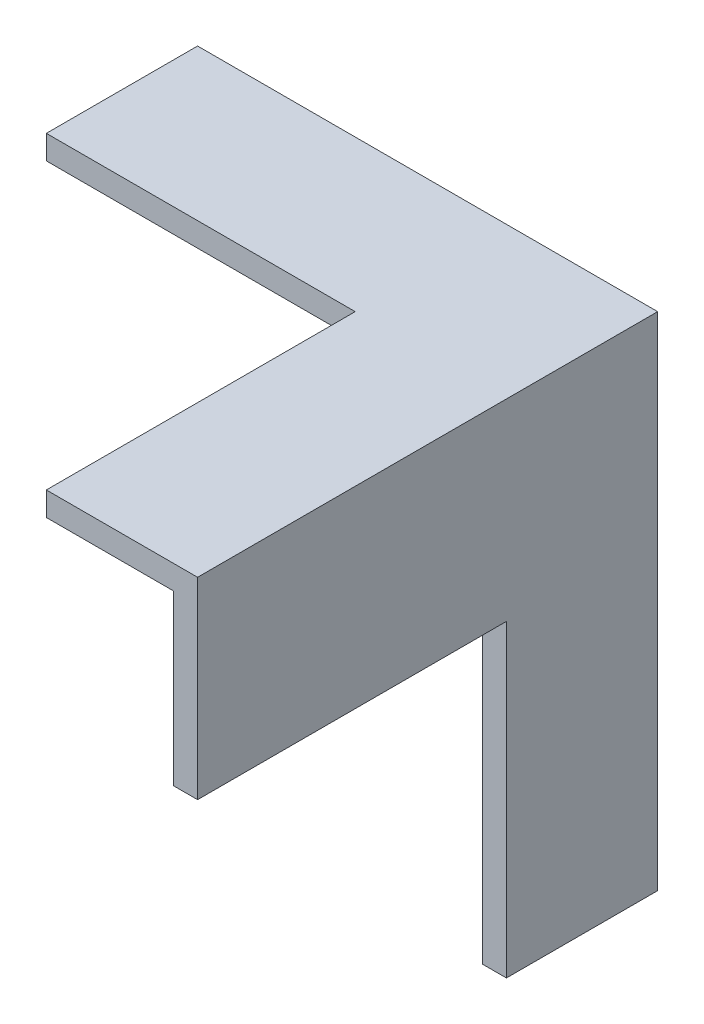
from build123d import *

# Parameters (mm, degrees)
BOSS_EXTRUDE1_DEPTH = 3.81
BOSS_EXTRUDE2_DEPTH = 3.81


with BuildPart() as part:
    # Sketch2 → Boss-Extrude1 (new body)
    with BuildSketch(Plane(origin=(0, 0, 0), x_dir=(0, 0, -1), z_dir=(1, 0, 0))):
        Polygon((0, 0), (73.406, 0), (73.406, -76.2), (49.276, -76.2), (49.276, -26.924), (0, -26.924), align=None)
    extrude(amount=BOSS_EXTRUDE1_DEPTH)

    # Sketch5 → Boss-Extrude2 (add)
    with BuildSketch(Plane(origin=(0, 0, 0), x_dir=(1, 0, 0), z_dir=(0, 1, 0))):
        Polygon((-69.596, 73.406), (3.81, 73.406), (3.81, 0), (-20.32, 0), (-20.32, 49.276), (-69.596, 49.276), align=None)
    extrude(amount=BOSS_EXTRUDE2_DEPTH)


solid = part.part
